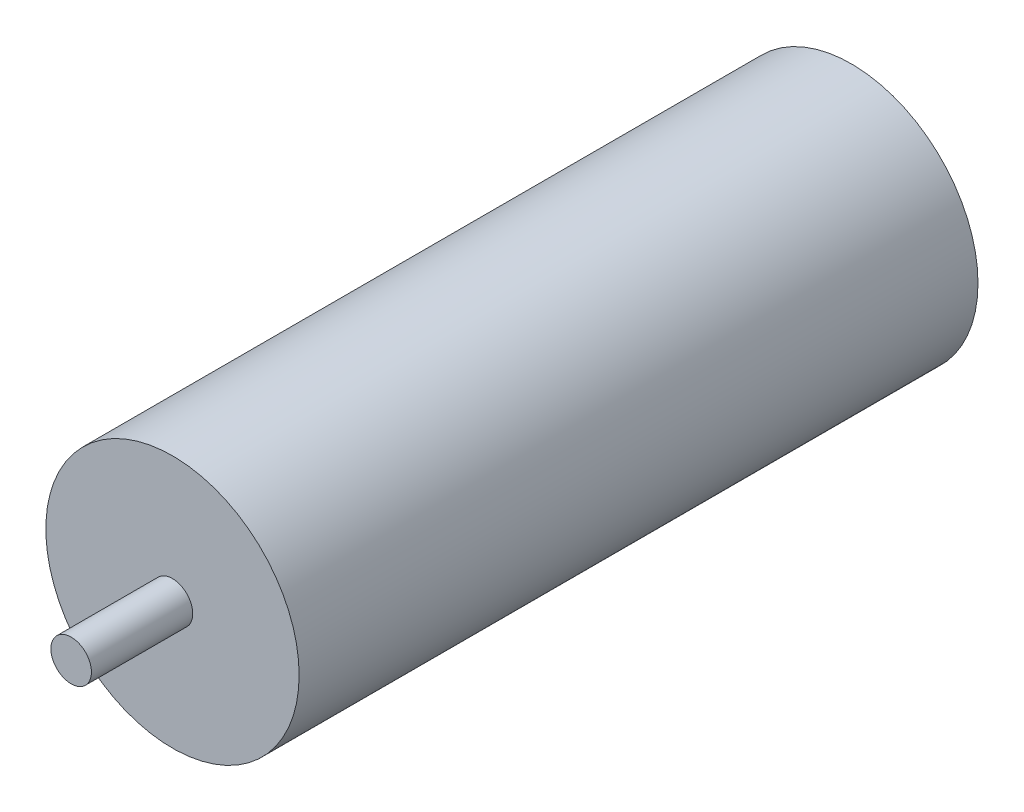
from build123d import *

# Parameters (mm, degrees)
ESQUISSE1_R             = 12.5
BOSS_EXTRU_1_DEPTH      = 77
ESQUISSE2_R             = 15.692851323
ESQUISSE2_R_2           = 2
ENL_V_MAT_EXTRU_1_DEPTH = 10


with BuildPart() as part:
    # Esquisse1 → Boss.-Extru.1 (new body)
    with BuildSketch(Plane.XY):
        Circle(ESQUISSE1_R)
    extrude(amount=BOSS_EXTRU_1_DEPTH)

    # Esquisse2 → Enlèv. mat.-Extru.1 (cut)
    with BuildSketch(Plane.XY.offset(77)):
        Circle(ESQUISSE2_R)
        Circle(ESQUISSE2_R_2, mode=Mode.SUBTRACT)
    extrude(amount=-ENL_V_MAT_EXTRU_1_DEPTH, mode=Mode.SUBTRACT)


solid = part.part
